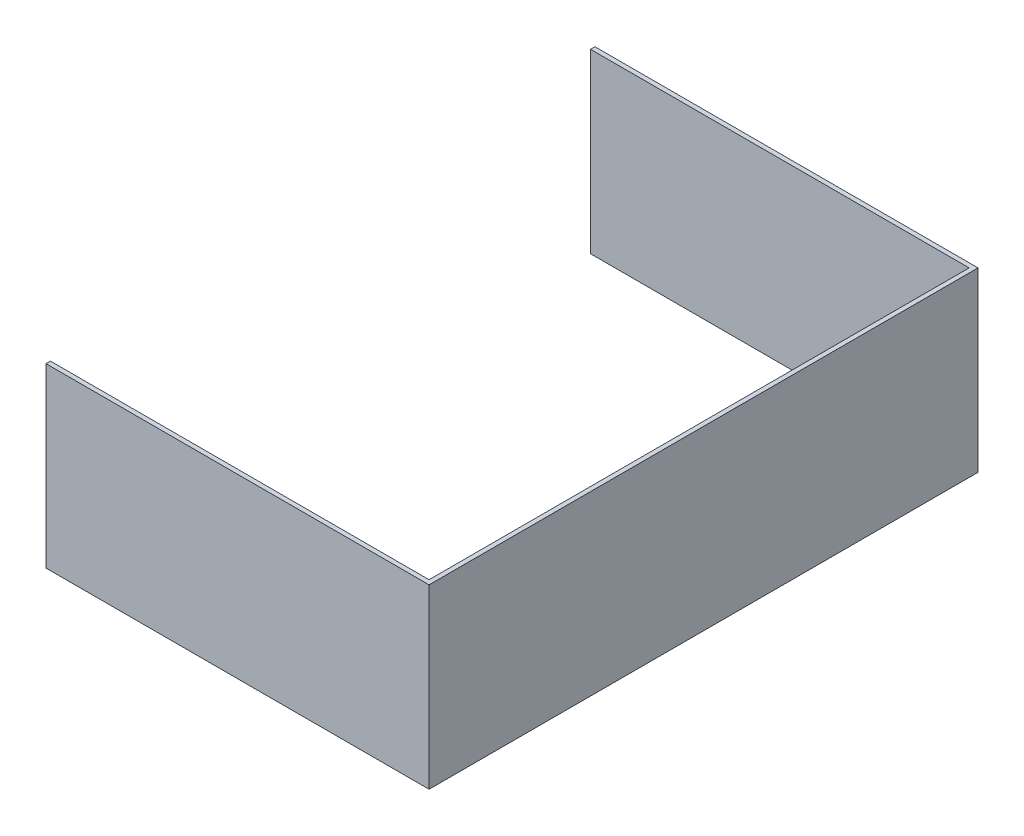
from build123d import *

# Parameters (mm, degrees)
SALIENTE_EXTRUIR1_DEPTH = 100


with BuildPart() as part:
    # Croquis1 → Saliente-Extruir1 (new body)
    with BuildSketch(Plane(origin=(0, 0, 0), x_dir=(1, 0, 0), z_dir=(0, 1, 0))):
        Polygon((0, 152.5), (213.83, 152.5), (213.83, -152.5), (0, -152.5), (0, -155), (216.33, -155), (216.33, 155), (0, 155), align=None)
    extrude(amount=SALIENTE_EXTRUIR1_DEPTH)


solid = part.part
